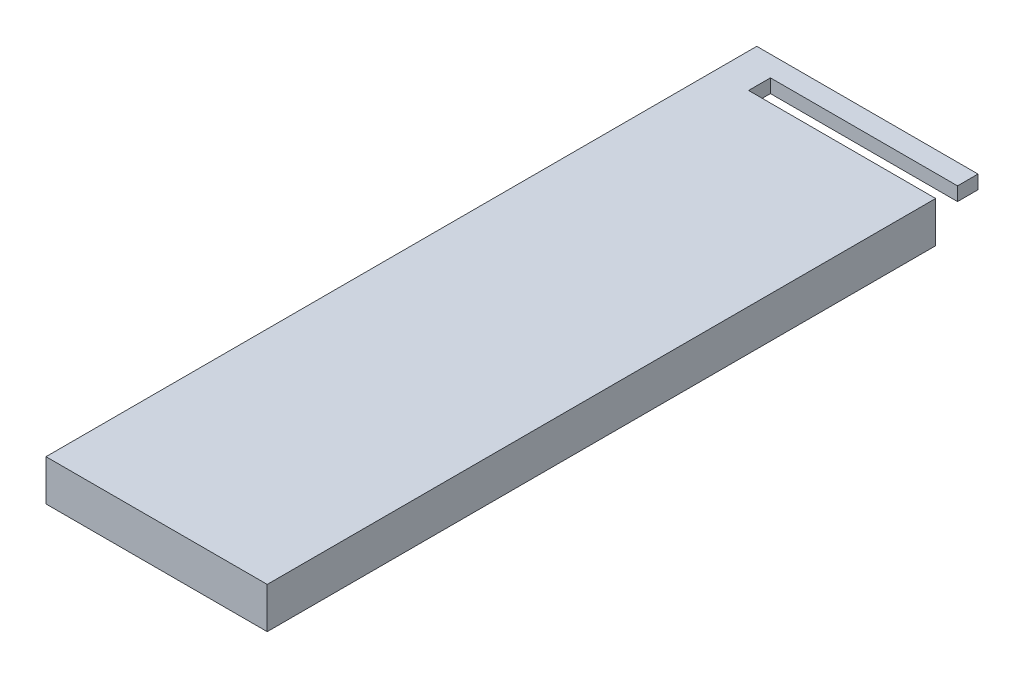
from build123d import *

# Parameters (mm, degrees)
BOSS_EXTRUDE1_DEPTH = 2
BOSS_EXTRUDE3_DEPTH = 6
SKETCH7_W           = 80.2
SKETCH7_H           = 2
BOSS_EXTRUDE4_DEPTH = 18.2
BOSS_EXTRUDE5_DEPTH = 2


with BuildPart() as part:
    # Sketch1 → Boss-Extrude1 (new body)
    with BuildSketch(Plane(origin=(0, 0, 0), x_dir=(1, 0, 0), z_dir=(0, 1, 0))):
        Polygon((0, 0), (30.4, 0), (30.4, 95.9), (18.2, 95.9), (18.2, 15.7), (0, 15.7), align=None)
    extrude(amount=BOSS_EXTRUDE1_DEPTH)

    # Sketch4 → Boss-Extrude3 (add)
    with BuildSketch(Plane(origin=(0, 2, 0), x_dir=(1, 0, 0), z_dir=(0, 1, 0))):
        Polygon((0, -2), (0, 0), (30.4, 0), (30.4, 95.9), (32.4, 95.9), (32.4, 0), (32.4, -2), align=None)
    extrude(amount=-BOSS_EXTRUDE3_DEPTH)

    # Sketch7 → Boss-Extrude4 (add)
    with BuildSketch(Plane.ZY.offset(-18.2)):
        with Locations((-55.8, 1)):
            Rectangle(SKETCH7_W, SKETCH7_H)
    extrude(amount=BOSS_EXTRUDE4_DEPTH)

    # Sketch8 → Boss-Extrude5 (add)
    with BuildSketch(Plane(origin=(0, 0, 0), x_dir=(-1, 0, 0), z_dir=(0, -1, 0))):
        Polygon((-5, 95.9), (0, 95.9), (0, 102.1), (-32.4, 102.1), (-32.4, 99.1), (-5, 99.1), align=None)
    extrude(amount=-BOSS_EXTRUDE5_DEPTH)


solid = part.part
